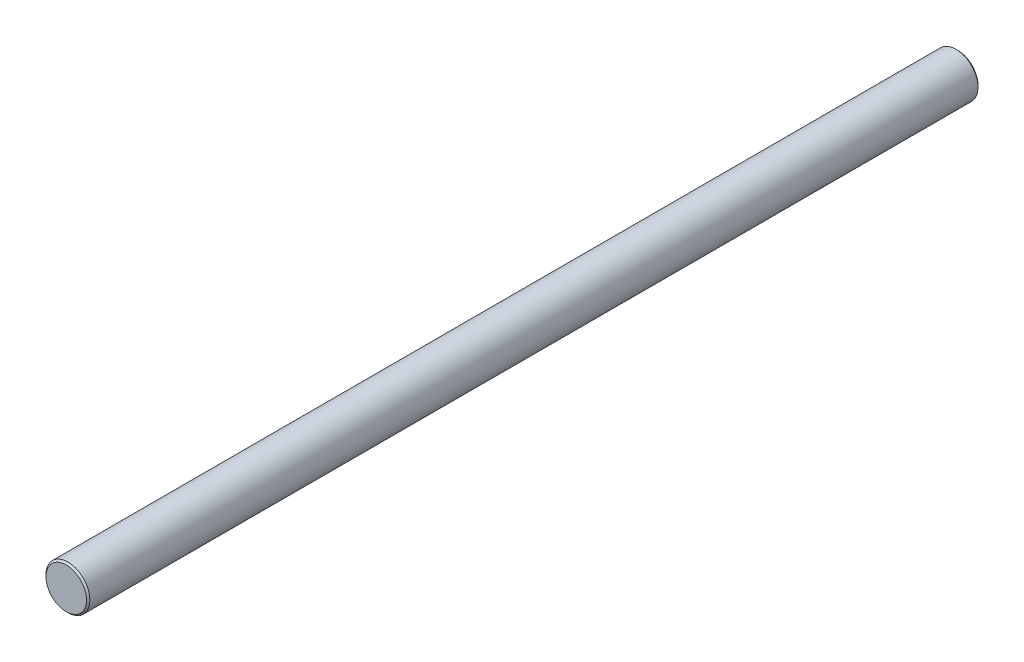
from build123d import *

# Parameters (mm, degrees)
SKETCH1_R           = 10
BOSS_EXTRUDE1_DEPTH = 203.2
CHAMFER1_SIZE       = 0.762


with BuildPart() as part:
    # Sketch1 → Boss-Extrude1 (new, symmetric)
    with BuildSketch(Plane.XY):
        Circle(SKETCH1_R)
    extrude(amount=BOSS_EXTRUDE1_DEPTH, both=True)

    # Chamfer1
    chamfer1_edges = [part.edges().sort_by_distance(p)[0] for p in [
        (-10, 0, -203.2),
        (-10, 0, 203.2),
    ]]
    chamfer(chamfer1_edges, length=CHAMFER1_SIZE)


solid = part.part
